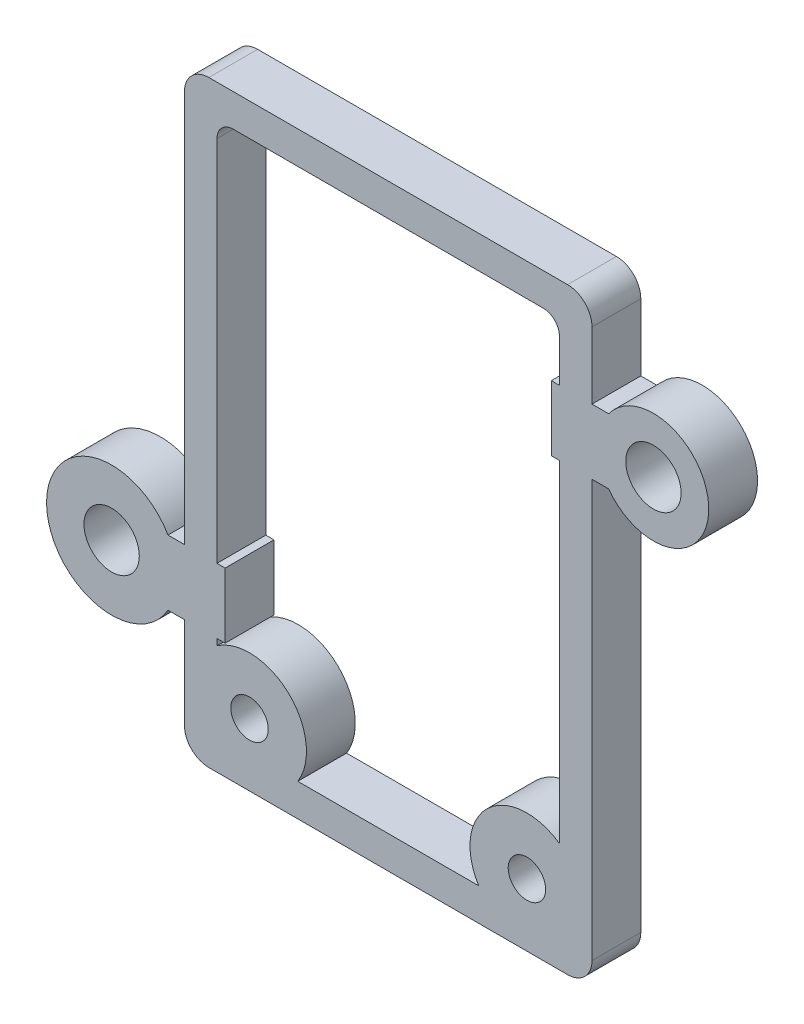
from build123d import *

# Parameters (mm, degrees)
PCB_EDGE_SUPPORT_DEPTH       = 3
SKETCH_2_R                   = 3.5
PCB_SCREW_LANDS_DEPTH        = 3
SKETCH_3_W                   = 6.975
SKETCH_3_H                   = 4
SKETCH_3_W_2                 = 5.975
FLOATING_MOUNT_BRIDGES_DEPTH = 3
SKETCH_4_R                   = 4
SKETCH_4_R_2                 = 3.4
FLOATING_MOUNT_EARS_DEPTH    = 3
SKETCH_5_R                   = 1.15
PCB_M2_CLEARANCE_DEPTH       = 4
SKETCH_6_R                   = 1.7
M2_ADJUSTMENT_0P7_DEPTH      = 4


with BuildPart() as part:
    # 草图1 → PCB_edge_support (new body)
    with BuildSketch(Plane.XY):
        with BuildLine():
            Line((1, -0.5), (23.05, -0.5))
            ThreePointArc((23.05, -0.5), (24.110660172, -0.060660172), (24.55, 1))
            Line((24.55, 1), (24.55, 34.73))
            ThreePointArc((24.55, 34.73), (24.110660172, 35.790660172), (23.05, 36.23))
            Line((23.05, 36.23), (1, 36.23))
            ThreePointArc((1, 36.23), (-0.060660172, 35.790660172), (-0.5, 34.73))
            Line((-0.5, 34.73), (-0.5, 1))
            ThreePointArc((-0.5, 1), (-0.060660172, -0.060660172), (1, -0.5))
        make_face()
        with BuildLine():
            Line((2.5, 1.5), (21.55, 1.5))
            ThreePointArc((21.55, 1.5), (22.257106781, 1.792893219), (22.55, 2.5))
            Line((22.55, 2.5), (22.55, 33.23))
            ThreePointArc((22.55, 33.23), (22.257106781, 33.937106781), (21.55, 34.23))
            Line((21.55, 34.23), (2.5, 34.23))
            ThreePointArc((2.5, 34.23), (1.792893219, 33.937106781), (1.5, 33.23))
            Line((1.5, 33.23), (1.5, 2.5))
            ThreePointArc((1.5, 2.5), (1.792893219, 1.792893219), (2.5, 1.5))
        make_face(mode=Mode.SUBTRACT)
    extrude(amount=PCB_EDGE_SUPPORT_DEPTH)

    # 草图2 → PCB_screw_lands (add)
    with BuildSketch(Plane.XY):
        with Locations((3.5, 3.36)):
            Circle(SKETCH_2_R)
        with Locations((20.55, 3.36)):
            Circle(SKETCH_2_R)
    extrude(amount=PCB_SCREW_LANDS_DEPTH)

    # 草图3 → Floating_mount_bridges (add)
    with BuildSketch(Plane.XY):
        with Locations((-1.4875, 8.62)):
            Rectangle(SKETCH_3_W, SKETCH_3_H)
        with Locations((25.0375, 28.62)):
            Rectangle(SKETCH_3_W_2, SKETCH_3_H)
    extrude(amount=FLOATING_MOUNT_BRIDGES_DEPTH)

    # 草图4 → Floating_mount_ears (add)
    with BuildSketch(Plane.XY):
        with Locations((-4.975, 8.62)):
            Circle(SKETCH_4_R)
        with Locations((28.325, 28.62)):
            Circle(SKETCH_4_R_2)
    extrude(amount=FLOATING_MOUNT_EARS_DEPTH)

    # 草图5 → PCB_M2_clearance (cut)
    with BuildSketch(Plane.XY):
        with Locations((3.5, 3.36)):
            Circle(SKETCH_5_R)
        with Locations((20.55, 3.36)):
            Circle(SKETCH_5_R)
    extrude(amount=PCB_M2_CLEARANCE_DEPTH, mode=Mode.SUBTRACT)

    # 草图6 → M2_adjustment_0p7 (cut)
    with BuildSketch(Plane.XY):
        with Locations((-4.975, 8.62)):
            Circle(SKETCH_6_R)
        with Locations((28.325, 28.62)):
            Circle(SKETCH_6_R)
    extrude(amount=M2_ADJUSTMENT_0P7_DEPTH, mode=Mode.SUBTRACT)


solid = part.part
